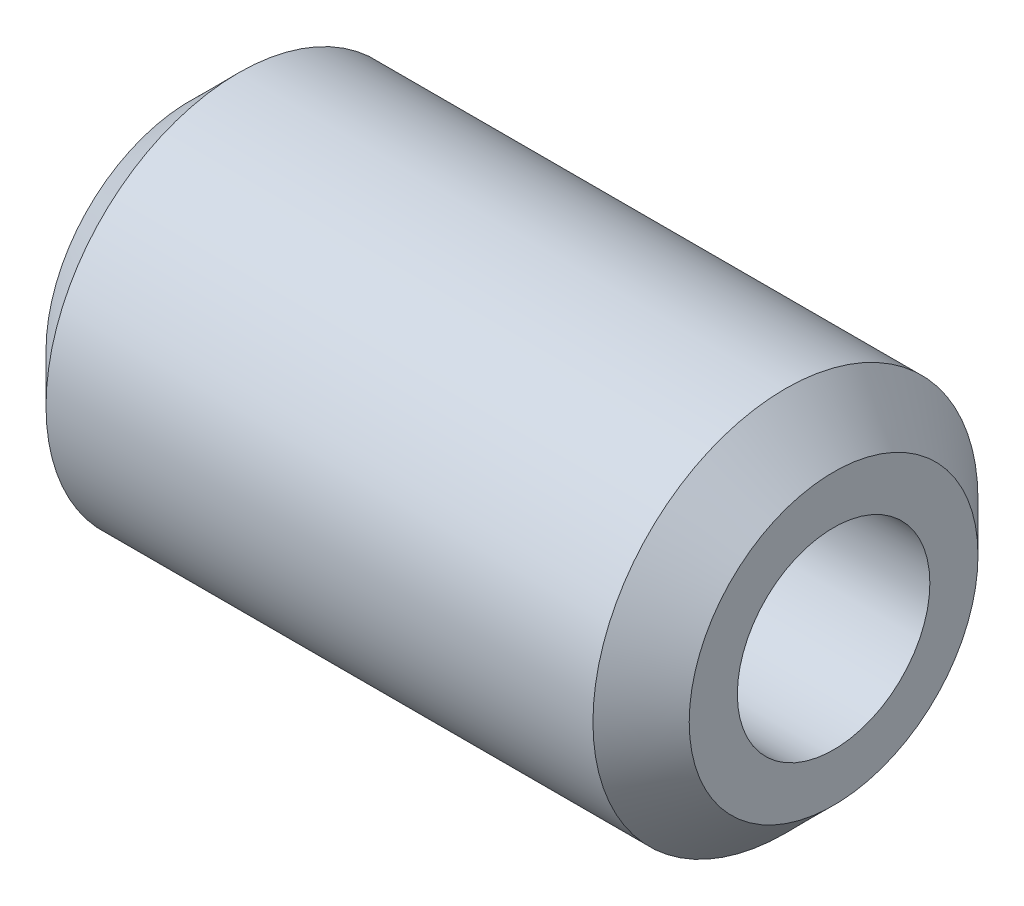
from build123d import *


with BuildPart() as part:
    # Sketch1 → Revolve1 (revolve)
    with BuildSketch(Plane.XY, mode=Mode.PRIVATE) as revolve1_sk:
        Polygon((-18.375, 5.5), (-18.375, 8.25), (-15.625, 11), (15.625, 11), (18.375, 8.25), (18.375, 5.5), align=None)
    revolve(revolve1_sk.sketch.rotate(Axis((-73.003968473, 0, 0), (1, 0, 0)), 90), axis=Axis((-73.003968473, 0, 0), (1, 0, 0)))


solid = part.part
